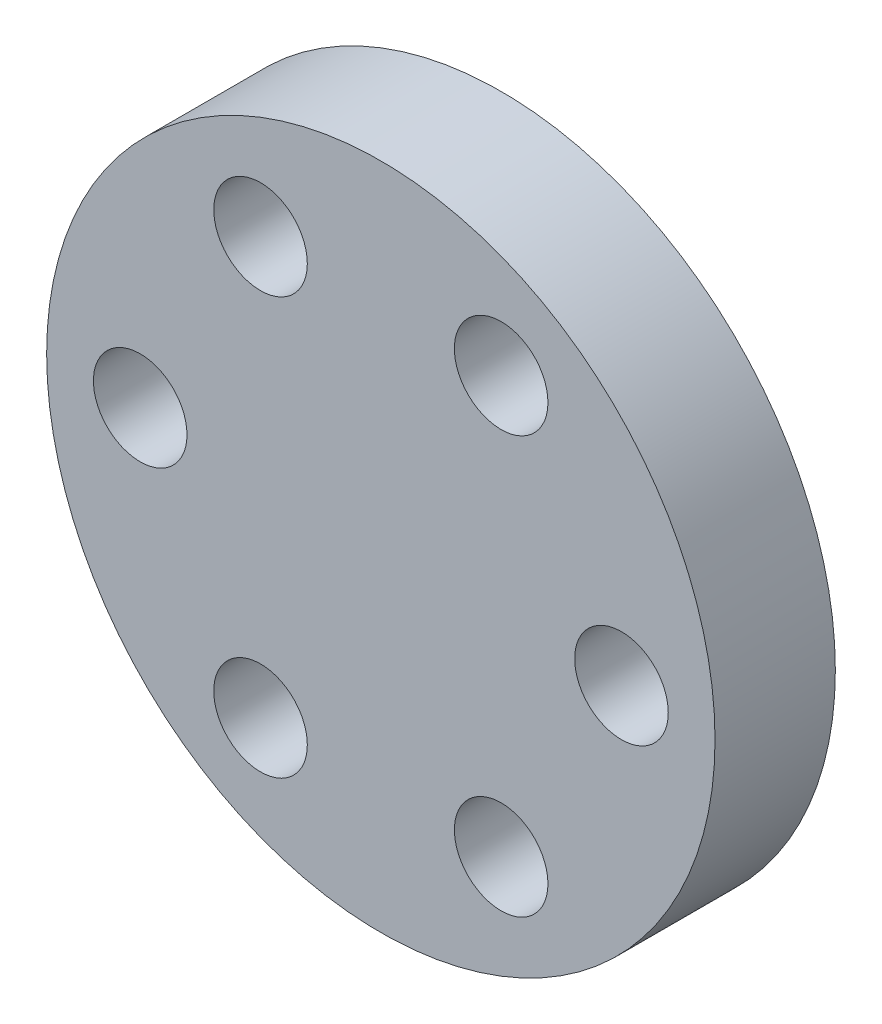
from build123d import *

# Parameters (mm, degrees)
SKETCH1_R           = 158.75
SKETCH1_R_2         = 22.225
BOSS_EXTRUDE1_DEPTH = 28.575


with BuildPart() as part:
    # Sketch1 → Boss-Extrude1 (new, symmetric)
    with BuildSketch(Plane(origin=(0, 0, 0), x_dir=(0, 1, 0), z_dir=(0, 0, 1))):
        with Locations(Location((0, 0, 0), (0, 0, 270))):
            Circle(SKETCH1_R)
        with Locations(Location((0, 114.3, 0), (0, 0, 270))):
            Circle(SKETCH1_R_2, mode=Mode.SUBTRACT)
        with Locations(Location((98.986703653, 57.15, 0), (0, 0, 270))):
            Circle(SKETCH1_R_2, mode=Mode.SUBTRACT)
        with Locations(Location((98.986703653, -57.15, 0), (0, 0, 270))):
            Circle(SKETCH1_R_2, mode=Mode.SUBTRACT)
        with Locations(Location((0, -114.3, 0), (0, 0, 270))):
            Circle(SKETCH1_R_2, mode=Mode.SUBTRACT)
        with Locations(Location((-98.986703653, -57.15, 0), (0, 0, 270))):
            Circle(SKETCH1_R_2, mode=Mode.SUBTRACT)
        with Locations(Location((-98.986703653, 57.15, 0), (0, 0, 270))):
            Circle(SKETCH1_R_2, mode=Mode.SUBTRACT)
    extrude(amount=BOSS_EXTRUDE1_DEPTH, both=True)


solid = part.part
